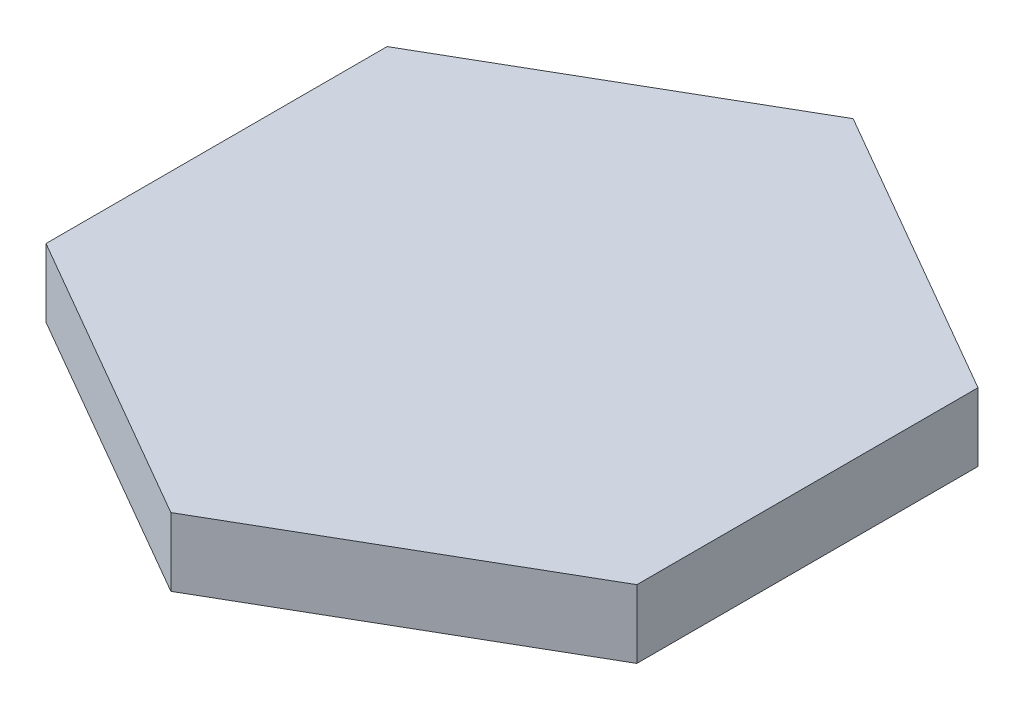
from build123d import *

# Parameters (mm, degrees)
BOSS_EXTRU_1_DEPTH = 15


with BuildPart() as part:
    # Esquisse1 → Boss.-Extru.1 (new body)
    with BuildSketch(Plane(origin=(0, 0, 0), x_dir=(1, 0, 0), z_dir=(0, 1, 0))):
        Polygon((0, 75), (-64.951905284, 37.5), (-64.951905284, -37.5), (0, -75), (64.951905284, -37.5), (64.951905284, 37.5), align=None)
    extrude(amount=BOSS_EXTRU_1_DEPTH)


solid = part.part
